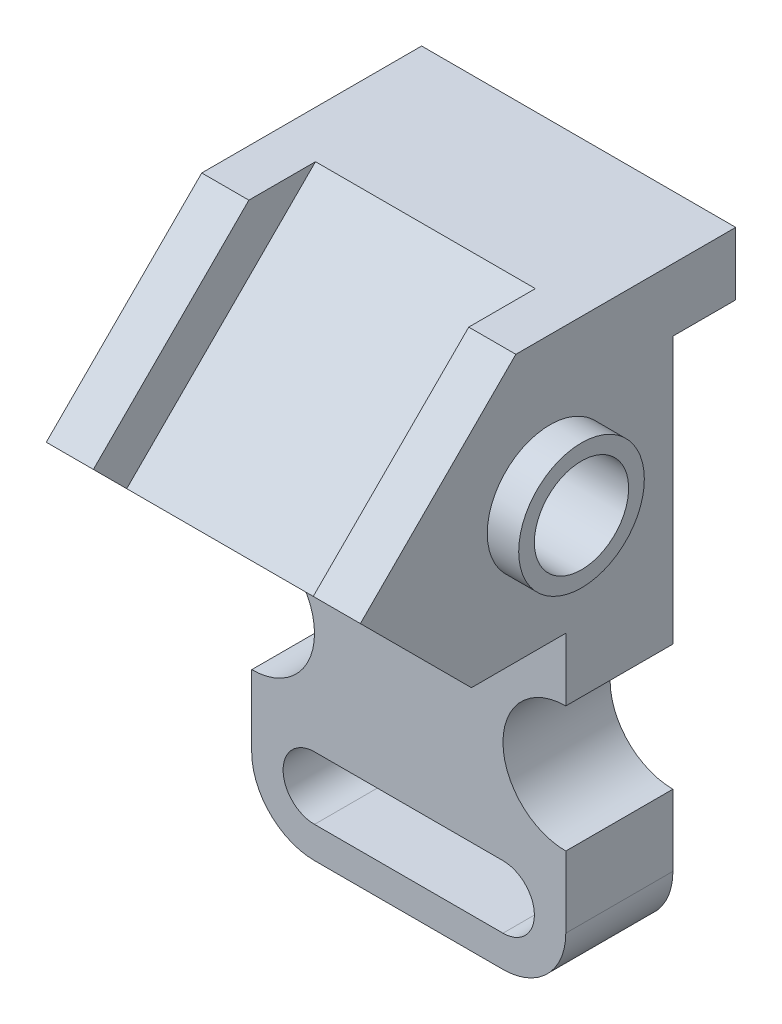
from build123d import *

# Parameters (mm, degrees)
EXTRUDE_1_DEPTH          = 34.1
FILLET_2_R               = 20
SKETCH_1_5_W             = 50
SKETCH_1_5_H             = 84.9
EXTRUDE_3_DEPTH          = 34.1
SKETCH_4_W               = 20
SKETCH_4_H               = 20
EXTRUDE_4_DEPTH          = 50
EXTRUDE_5_DEPTH          = 50
SKETCH_7_R               = 15
CUT_EXTRUDE_1_DEPTH      = 219.119470794
SKETCH_8_W               = 35
SKETCH_8_H               = 15
CUT_EXTRUDE_2_DEPTH      = 212.953207538
FILLET_2_OF_MIRROR_1_R   = 20
SKETCH_13_R              = 20
EXTRUDE_6_DEPTH          = 10
CUT_EXTRUDE_3_DEPTH      = 235.682985193
CUT_EXTRUDE_3_DEPTH_BACK = 235.682985193
SKETCH_15_R              = 15


with BuildPart() as part:
    # Эскиз1 → Бобышка-Вытянуть1 (new body)
    with BuildSketch(Plane.XY):
        with BuildLine():
            ThreePointArc((30, 10), (40, 20), (30, 30))
            Line((30, 30), (0, 30))
            Line((0, 30), (0, 102.653608526))
            Line((0, 102.653608526), (50, 102.653608526))
            Line((50, 102.653608526), (50, 82.653608526))
            ThreePointArc((50, 82.653608526), (30, 62.653608526), (50, 42.653608526))
            Line((50, 42.653608526), (50, 0))
            Line((50, 0), (0, 0))
            Line((0, 0), (0, 10))
            Line((0, 10), (30, 10))
        make_face()
    extrude_1 = extrude(amount=EXTRUDE_1_DEPTH)

    # Скругление2
    fillet_2_edges = [part.edges().sort_by_distance(p)[0] for p in [
        (50, 0, 17.05),
    ]]
    fillet(fillet_2_edges, radius=FILLET_2_R)

    # Эскиз1<5> → Бобышка-Вытянуть3 (add)
    with BuildSketch(Plane.XY):
        with Locations((25, 145.103608526)):
            Rectangle(SKETCH_1_5_W, SKETCH_1_5_H)
    extrude_3 = extrude(amount=EXTRUDE_3_DEPTH)

    # Эскиз4 → Бобышка-Вытянуть4 (add)
    with BuildSketch(Plane(origin=(50, 0, 0), x_dir=(0, 0, -1), z_dir=(1, 0, 0))):
        with Locations((10, 177.553608526)):
            Rectangle(SKETCH_4_W, SKETCH_4_H)
    extrude_4 = extrude(amount=-EXTRUDE_4_DEPTH)

    # Эскиз5 → Бобышка-Вытянуть5 (add)
    with BuildSketch(Plane(origin=(50, 0, 0), x_dir=(0, 0, -1), z_dir=(1, 0, 0))):
        Polygon((-34.1, 187.553608526), (-50, 187.553608526), (-99.497474683, 138.056133842), (-64.142135624, 102.700794783), (-34.1, 102.700794783), align=None)
    extrude_5 = extrude(amount=-EXTRUDE_5_DEPTH)

    # Эскиз7 → Вырез-Вытянуть1 (cut, symmetric)
    with BuildSketch(Plane(origin=(50, 0, 0), x_dir=(0, 0, -1), z_dir=(1, 0, 0))):
        with Locations((-39.1, 142.700794783)):
            Circle(SKETCH_7_R)
    cut_extrude_1 = extrude(amount=CUT_EXTRUDE_1_DEPTH, both=True, mode=Mode.SUBTRACT)

    # Эскиз8 → Вырез-Вытянуть2 (cut, through all)
    with BuildSketch(Plane(origin=(0, 19.27932958, -19.27932958), x_dir=(1, 0, 0), z_dir=(0, -0.7071067811865498, 0.7071067811865454))):
        with Locations((17.5, 160.475767484)):
            Rectangle(SKETCH_8_W, SKETCH_8_H)
    cut_extrude_2 = extrude(amount=-CUT_EXTRUDE_2_DEPTH, mode=Mode.SUBTRACT)

    # Зеркальное отражение1: Бобышка-Вытянуть1, Бобышка-Вытянуть3, Бобышка-Вытянуть4, Бобышка-Вытянуть5, Вырез-Вытянуть1, Вырез-Вытянуть2 across plane
    add(extrude_1.mirror(Plane(origin=(0, 0, 34.1), x_dir=(0, 0, 1), z_dir=(1, 0, 0))))
    add(extrude_3.mirror(Plane(origin=(0, 0, 34.1), x_dir=(0, 0, 1), z_dir=(1, 0, 0))))
    add(extrude_4.mirror(Plane(origin=(0, 0, 34.1), x_dir=(0, 0, 1), z_dir=(1, 0, 0))))
    add(extrude_5.mirror(Plane(origin=(0, 0, 34.1), x_dir=(0, 0, 1), z_dir=(1, 0, 0))))
    add(cut_extrude_1.mirror(Plane(origin=(0, 0, 34.1), x_dir=(0, 0, 1), z_dir=(1, 0, 0))), mode=Mode.SUBTRACT)
    add(cut_extrude_2.mirror(Plane(origin=(0, 0, 34.1), x_dir=(0, 0, 1), z_dir=(1, 0, 0))), mode=Mode.SUBTRACT)

    # Скругление2 of Зеркальное отражение1
    fillet_2_of_mirror_1_edges = [part.edges().sort_by_distance(p)[0] for p in [
        (-50, 0, 17.05),
    ]]
    fillet(fillet_2_of_mirror_1_edges, radius=FILLET_2_OF_MIRROR_1_R)

    # Эскиз13 → Бобышка-Вытянуть6 (add)
    with BuildSketch(Plane(origin=(50, 0, 0), x_dir=(0, 0, -1), z_dir=(1, 0, 0))):
        with Locations(Location((-39.1, 142.700794783, 0), (0, 0, 180))):
            Circle(SKETCH_13_R)
    extrude(amount=EXTRUDE_6_DEPTH)

    # Эскиз15 → Вырез-Вытянуть3 (cut, two sides: drawn at the far end of the back side and taken through both)
    with BuildSketch(Plane.ZY.offset(-50).offset(-CUT_EXTRUDE_3_DEPTH_BACK)):
        with Locations(Location((39.1, 142.700794783, 0), (0, 0, 270))):
            Circle(SKETCH_15_R)
    extrude(amount=CUT_EXTRUDE_3_DEPTH + CUT_EXTRUDE_3_DEPTH_BACK, mode=Mode.SUBTRACT)


solid = part.part
